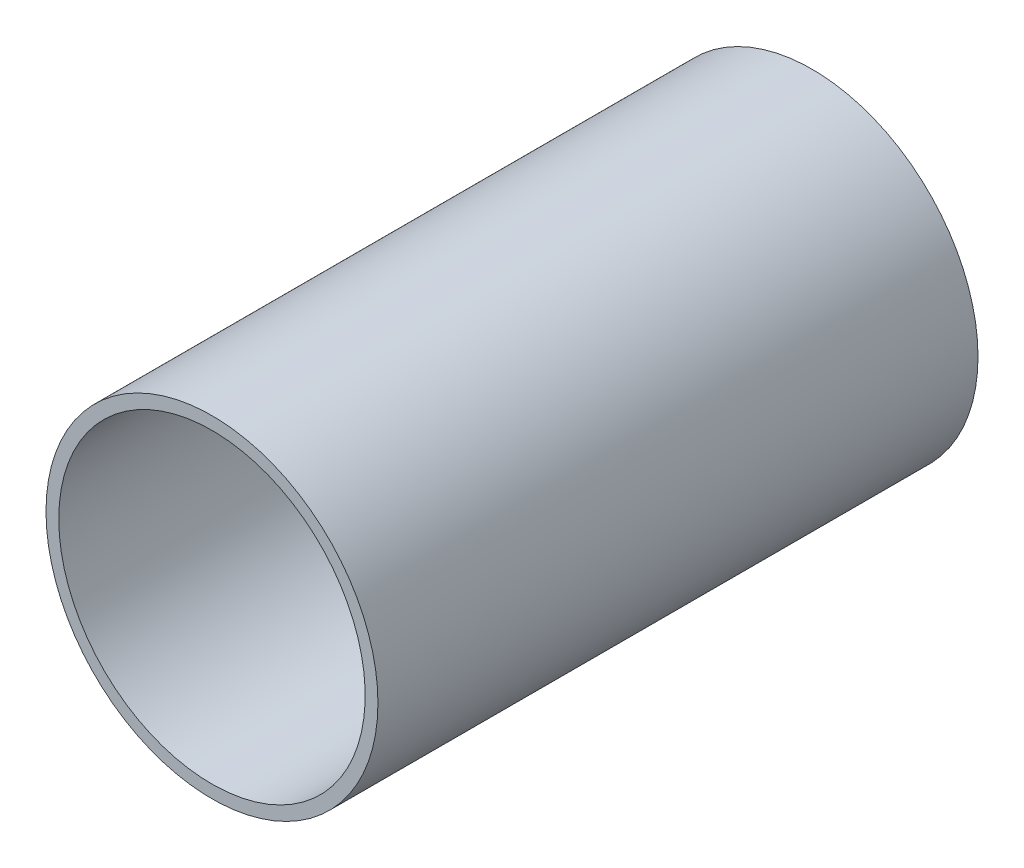
from build123d import *

# Parameters (mm, degrees)
ESQUISSE1_W = 6.35
ESQUISSE1_H = 298.45


with BuildPart() as part:
    # Esquisse1 → Révolution1 (revolve)
    with BuildSketch(Plane.XZ, mode=Mode.PRIVATE) as r_volution1_sk:
        with Locations((79.375, 0)):
            Rectangle(ESQUISSE1_W, ESQUISSE1_H)
    revolve(r_volution1_sk.sketch.rotate(Axis((0, 0, 149.225), (0, 0, -1)), 180), axis=Axis((0, 0, 149.225), (0, 0, -1)))


solid = part.part
